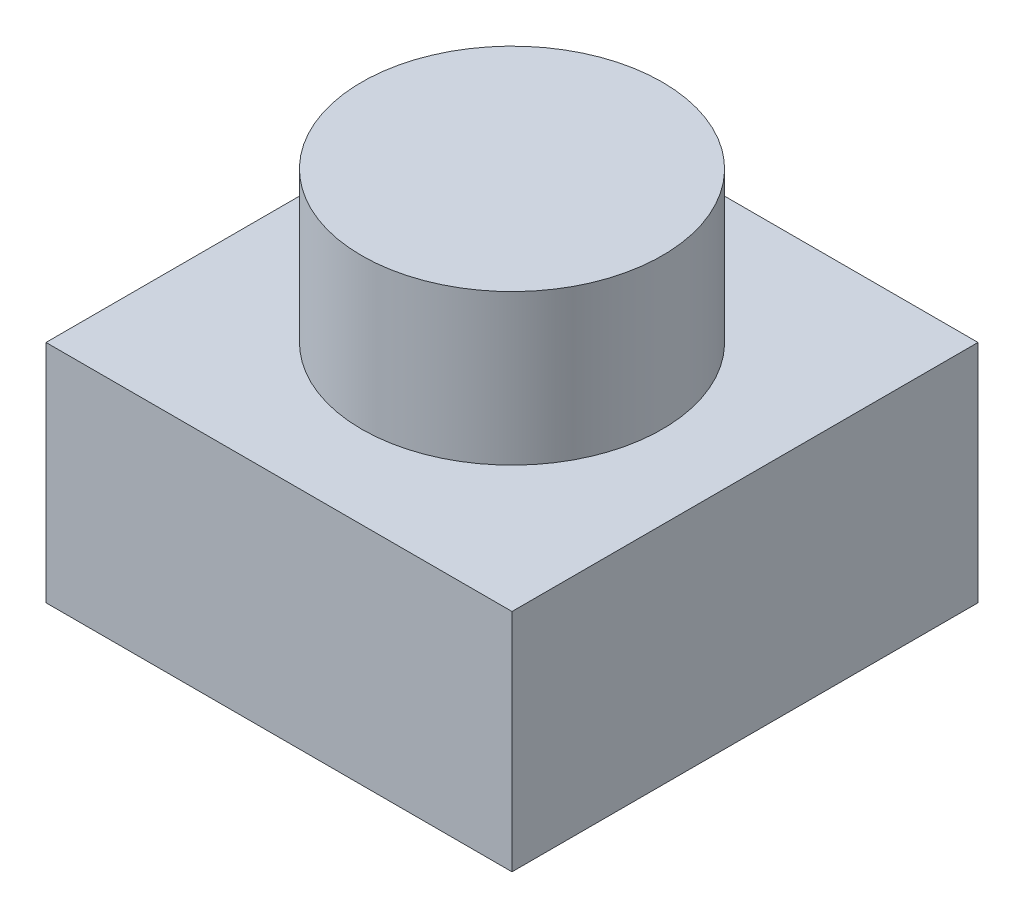
from build123d import *

# Parameters (mm, degrees)
SKETCH1_W           = 6.2
SKETCH1_H           = 6.2
BOSS_EXTRUDE1_DEPTH = 3
SKETCH2_R           = 2
BOSS_EXTRUDE2_DEPTH = 2


with BuildPart() as part:
    # Sketch1 → Boss-Extrude1 (new body)
    with BuildSketch(Plane(origin=(0, 0, 0), x_dir=(1, 0, 0), z_dir=(0, 1, 0))):
        Rectangle(SKETCH1_W, SKETCH1_H)
    extrude(amount=BOSS_EXTRUDE1_DEPTH)

    # Sketch2 → Boss-Extrude2 (add)
    with BuildSketch(Plane(origin=(0, 3, 0), x_dir=(1, 0, 0), z_dir=(0, 1, 0))):
        with Locations(Location((0, 0, 0), (0, 0, 270))):
            Circle(SKETCH2_R)
    extrude(amount=BOSS_EXTRUDE2_DEPTH)


solid = part.part
